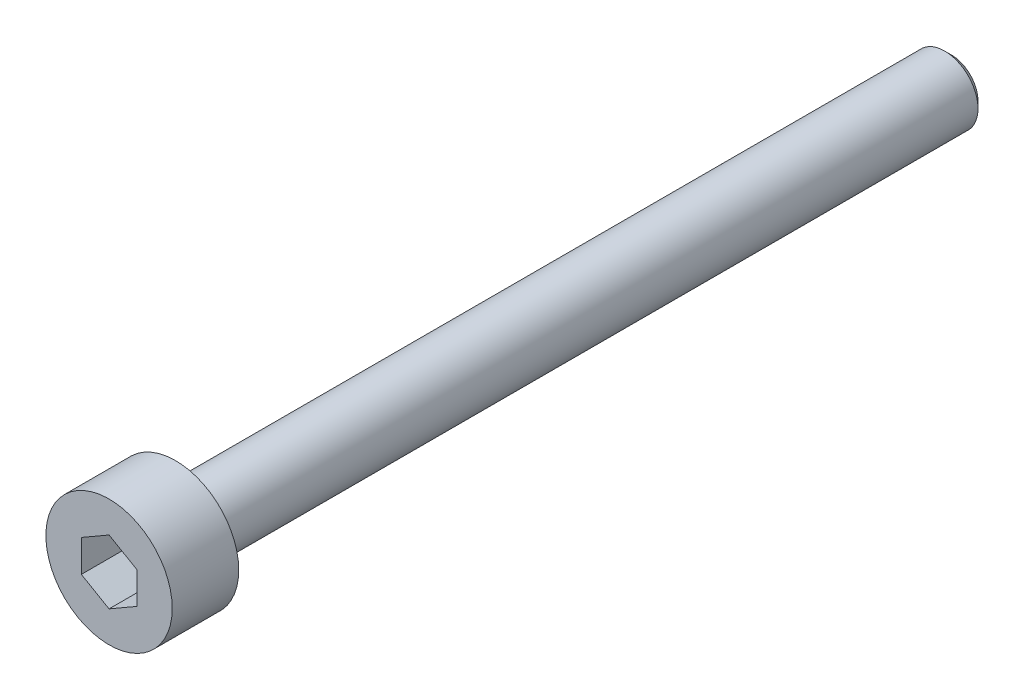
from build123d import *

# Parameters (mm, degrees)
SKETCH1_R           = 2.85
BOSS_EXTRUDE1_DEPTH = 3
SKETCH2_R           = 1.5
BOSS_EXTRUDE2_DEPTH = 35
CHAMFER1_SIZE       = 0.3
CUT_EXTRUDE1_DEPTH  = 2


with BuildPart() as part:
    # Sketch1 → Boss-Extrude1 (new body)
    with BuildSketch(Plane.XY):
        Circle(SKETCH1_R)
    extrude(amount=BOSS_EXTRUDE1_DEPTH)

    # Sketch2 → Boss-Extrude2 (add)
    with BuildSketch(Plane(origin=(0, 0, 0), x_dir=(-1, 0, 0), z_dir=(0, 0, -1))):
        with Locations(Location((0, 0, 0), (0, 0, 180))):
            Circle(SKETCH2_R)
    extrude(amount=BOSS_EXTRUDE2_DEPTH)

    # Chamfer1
    chamfer1_edges = [part.edges().sort_by_distance(p)[0] for p in [
        (-1.5, 0, -35),
    ]]
    chamfer(chamfer1_edges, length=CHAMFER1_SIZE)

    # Sketch3 → Cut-Extrude1 (cut)
    with BuildSketch(Plane.XY.offset(3)):
        Polygon((0, 1.443375673), (-1.25, 0.721687836), (-1.25, -0.721687836), (0, -1.443375673), (1.25, -0.721687836), (1.25, 0.721687836), align=None)
    extrude(amount=-CUT_EXTRUDE1_DEPTH, mode=Mode.SUBTRACT)


solid = part.part
